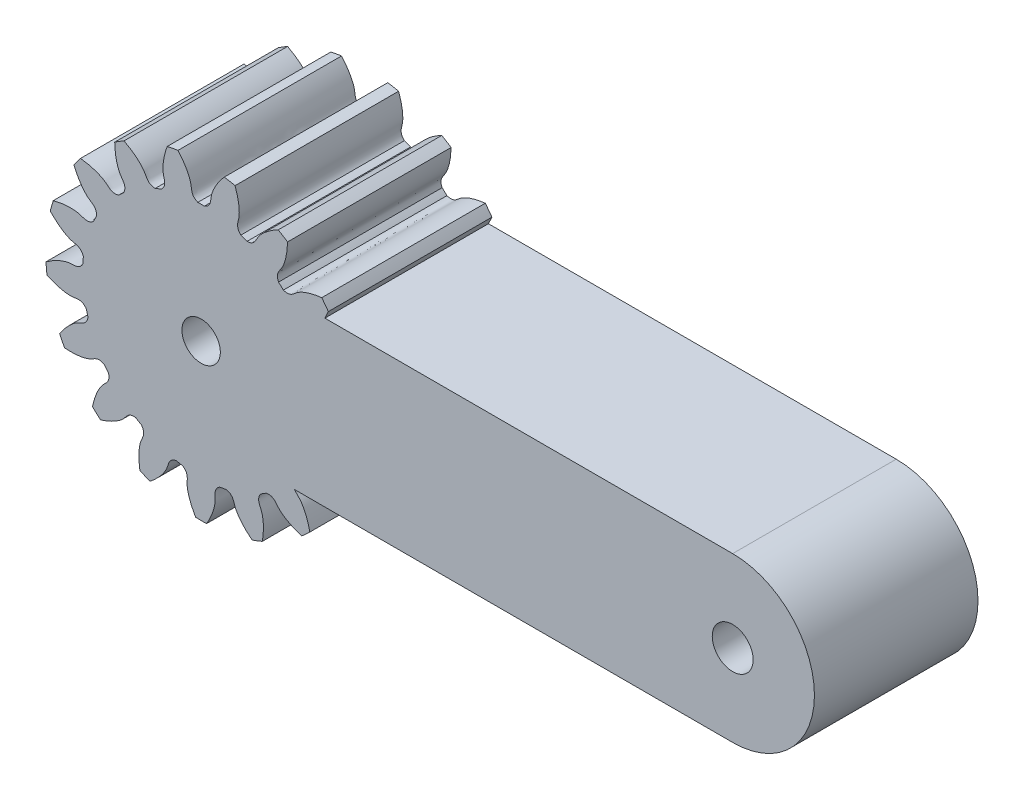
from build123d import *

# Parameters (mm, degrees)
SKETCH_1_R               = 19
EXTRUDE_1_DEPTH          = 20
CUT_EXTRUDE_1_DEPTH      = 34.496268449
PATTERN_CIRCULAR_1_COUNT = 17
EXTRUDE_2_DEPTH          = 20
SKETCH_5_R               = 2.347946868
SKETCH_5_R_2             = 2.5
CUT_EXTRUDE_2_DEPTH      = 20


with BuildPart() as part:
    # 草图1 → 凸台-拉伸1 (new body)
    with BuildSketch(Plane.XY):
        Circle(SKETCH_1_R)
    extrude(amount=EXTRUDE_1_DEPTH)

    # 草图2 → 切除-拉伸1 (cut, through all)
    with BuildSketch(Plane.XY):
        with BuildLine():
            ThreePointArc((0.403387494, 14.494387829), (0, 14.5), (-0.403387494, 14.494387829))
            add(Edge.make_bspline(
                [(-0.403387494, 14.494387829), (-1.255759481, 14.849644042), (-1.132390756, 15.509626813), (-1.276611209, 16.129648275), (-1.289951469, 16.18230119), (-1.306037005, 16.240838627), (-1.32510118, 16.305170665), (-1.347383555, 16.375198727), (-1.373118159, 16.450817515), (-1.40253689, 16.531914502), (-1.435868224, 16.618370188), (-1.473337358, 16.710058129), (-1.515165928, 16.80684504), (-1.561571855, 16.908590882), (-1.612769151, 17.015148962), (-1.66896775, 17.12636603), (-1.730373323, 17.242082389), (-1.797187111, 17.362132), (-1.869605751, 17.4863426), (-1.947821109, 17.61453582), (-2.032020115, 17.746527309), (-2.1223846, 17.882126855), (-2.219091138, 18.021138524), (-2.32231089, 18.163360791), (-2.432209452, 18.308586678), (-2.548946705, 18.456603899), (-2.67267667, 18.607195006), (-2.803547366, 18.760137539), (-2.941700674, 18.915204179), (-3.087272199, 19.072162909), (-3.24039114, 19.23077717), (-3.401180166, 19.390806026), (-3.569755292, 19.552004336), (-3.746225758, 19.71412292), (-3.930693918, 19.876908731), (-4.123255131, 20.040105038), (-4.323997649, 20.203451599), (-4.533002522, 20.366684847), (-4.750343497, 20.529538073), (-4.976086928, 20.691741613), (-5.210291694, 20.853023038), (-5.453009069, 21.013107349), (-5.79164327, 21.226861067), (-6.053153804, 21.381051942), (-6.231291666, 21.481438237)],
                knots=[0, 0, 0, 0, 0.193882922, 0.199023975, 0.204850501, 0.211362501, 0.218559975, 0.226442923, 0.235011345, 0.24426524, 0.254204608, 0.264829451, 0.276139767, 0.288135557, 0.300816821, 0.314183558, 0.328235769, 0.342973453, 0.358396612, 0.374505244, 0.39129935, 0.408778929, 0.426943982, 0.445794509, 0.46533051, 0.485551984, 0.506458932, 0.528051354, 0.550329249, 0.573292619, 0.596941461, 0.621275778, 0.646295568, 0.672000832, 0.69839157, 0.725467781, 0.753229466, 0.781676625, 0.810809257, 0.840627364, 0.871130943, 0.902319997, 0.934194524, 1, 1, 1, 1], degree=3))
            ThreePointArc((-6.231291666, 21.481438237), (0, 22.366966369), (6.231291666, 21.481438237))
            add(Edge.make_bspline(
                [(0.403387494, 14.494387829), (1.255759481, 14.849644042), (1.132390756, 15.509626813), (1.276611209, 16.129648275), (1.289951469, 16.18230119), (1.306037005, 16.240838627), (1.32510118, 16.305170665), (1.347383555, 16.375198727), (1.373118159, 16.450817515), (1.40253689, 16.531914502), (1.435868224, 16.618370188), (1.473337358, 16.710058129), (1.515165928, 16.80684504), (1.561571855, 16.908590882), (1.612769151, 17.015148962), (1.66896775, 17.12636603), (1.730373323, 17.242082389), (1.797187111, 17.362132), (1.869605751, 17.4863426), (1.947821109, 17.61453582), (2.032020115, 17.746527309), (2.1223846, 17.882126855), (2.219091138, 18.021138524), (2.32231089, 18.163360791), (2.432209452, 18.308586678), (2.548946705, 18.456603899), (2.67267667, 18.607195006), (2.803547366, 18.760137539), (2.941700674, 18.915204179), (3.087272199, 19.072162909), (3.24039114, 19.23077717), (3.401180166, 19.390806026), (3.569755292, 19.552004336), (3.746225758, 19.71412292), (3.930693918, 19.876908731), (4.123255131, 20.040105038), (4.323997649, 20.203451599), (4.533002522, 20.366684847), (4.750343497, 20.529538073), (4.976086928, 20.691741613), (5.210291694, 20.853023038), (5.453009069, 21.013107349), (5.79164327, 21.226861067), (6.053153804, 21.381051942), (6.231291666, 21.481438237)],
                knots=[0, 0, 0, 0, 0.193882922, 0.199023975, 0.204850501, 0.211362501, 0.218559975, 0.226442923, 0.235011345, 0.24426524, 0.254204608, 0.264829451, 0.276139767, 0.288135557, 0.300816821, 0.314183558, 0.328235769, 0.342973453, 0.358396612, 0.374505244, 0.39129935, 0.408778929, 0.426943982, 0.445794509, 0.46533051, 0.485551984, 0.506458932, 0.528051354, 0.550329249, 0.573292619, 0.596941461, 0.621275778, 0.646295568, 0.672000832, 0.69839157, 0.725467781, 0.753229466, 0.781676625, 0.810809257, 0.840627364, 0.871130943, 0.902319997, 0.934194524, 1, 1, 1, 1], degree=3))
        make_face()
    cut_extrude_1 = extrude(amount=CUT_EXTRUDE_1_DEPTH, mode=Mode.SUBTRACT)

    # 阵列(圆周)1: 切除-拉伸1 ×17 about axis
    pattern_circular_1_axis = Axis((0, 0, -1.5), (0, 0, 1))
    for i in range(1, PATTERN_CIRCULAR_1_COUNT):
        add(cut_extrude_1.rotate(pattern_circular_1_axis, i * 360 / PATTERN_CIRCULAR_1_COUNT), mode=Mode.SUBTRACT)

    # 草图4 → 凸台-拉伸2 (add)
    with BuildSketch(Plane.XY.offset(20)):
        with BuildLine():
            Line((0, 10), (65, 10))
            ThreePointArc((65, 10), (75, 0), (65, -10))
            Line((65, -10), (0, -10))
            ThreePointArc((0, -10), (-10, 0), (0, 10))
        make_face()
    extrude(amount=-EXTRUDE_2_DEPTH)

    # 草图5 → 切除-拉伸2 (cut)
    with BuildSketch(Plane(origin=(0, 0, 0), x_dir=(-1, 0, 0), z_dir=(0, 0, -1))):
        Circle(SKETCH_5_R)
        with Locations((-65, 0)):
            Circle(SKETCH_5_R_2)
    extrude(amount=-CUT_EXTRUDE_2_DEPTH, mode=Mode.SUBTRACT)


solid = part.part
